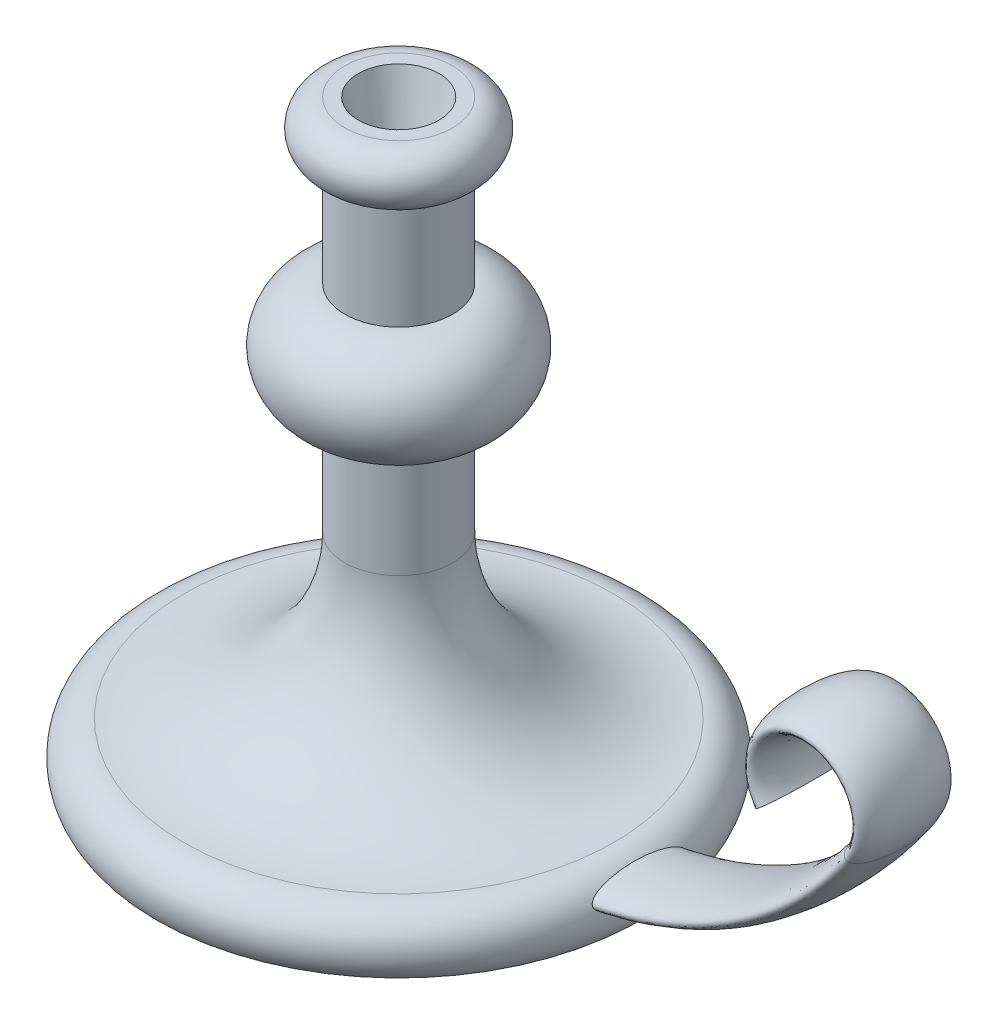
from build123d import *

# Parameters (mm, degrees)
SKETCH4_RX         = 17.5
SKETCH4_RY         = 5
SKETCH5_R          = 15
CUT_EXTRUDE1_DEPTH = 25
CUT_EXTRUDE1_DRAFT = -15


with BuildPart() as part:
    # Sketch1 → Revolve1 (revolve)
    with BuildSketch(Plane.XY, mode=Mode.PRIVATE) as revolve1_sk:
        with BuildLine():
            Line((0, 0), (0, 220))
            Line((0, 220), (20, 220))
            ThreePointArc((20, 220), (30, 210), (20, 200))
            Line((20, 200), (20, 160))
            ThreePointArc((20, 160), (40, 140), (20, 120))
            Line((20, 120), (20, 80))
            ThreePointArc((20, 80), (37.574317118, 37.574237015), (80.001481091, 20.003302372))
            ThreePointArc((80.001481091, 20.003302372), (91.183517788, 13.092071658), (90, 0))
            Line((90, 0), (0, 0))
        make_face()
    revolve(revolve1_sk.sketch.rotate(Axis((0, 0, 0), (0, 1, 0)), 90), axis=Axis((0, 0, 0), (0, 1, 0)))

    # Sweep1: sweep along a path in Sketch2
    with BuildLine(Plane.XY) as sweep1_path:
        Line((0, 10), (60, 10))
        ThreePointArc((60, 10), (129.821200219, 27.240819526), (183.592070943, 75))
        ThreePointArc((183.592070943, 75), (167.113128151, 106.333333333), (150.634185358, 75))
    # Sketch4 → Sweep1 (sweep)
    with BuildSketch(Plane(origin=(0, 0, 0), x_dir=(0, 0, -1), z_dir=(1, 0, 0))):
        with Locations((0, 10)):
            Ellipse(SKETCH4_RX, SKETCH4_RY)
    sweep(path=sweep1_path.line)


with BuildPart() as cut_extrude1_tool:
    # Sketch5 → Cut-Extrude1 (with draft: the straight prism first)
    with BuildSketch(Plane(origin=(0, 220, 0), x_dir=(1, 0, 0), z_dir=(0, 1, 0))):
        Circle(SKETCH5_R)
    extrude(amount=-CUT_EXTRUDE1_DEPTH)
    # Cut-Extrude1: the draft: its side faces are tilted about the plane it starts from
    cut_extrude1_sides = [cut_extrude1_tool.faces().sort_by_distance(p)[0] for p in [
        (-15, 207.5, 0),
    ]]
    draft(cut_extrude1_sides, Plane(origin=(0, 220, 0), x_dir=(1, 0, 0), z_dir=(0, 1, 0)), CUT_EXTRUDE1_DRAFT)


with BuildPart() as part_1:
    add(part.part)

    # Cut-Extrude1: cut by cut_extrude1_tool
    add(cut_extrude1_tool.part, mode=Mode.SUBTRACT)


solid = part_1.part
